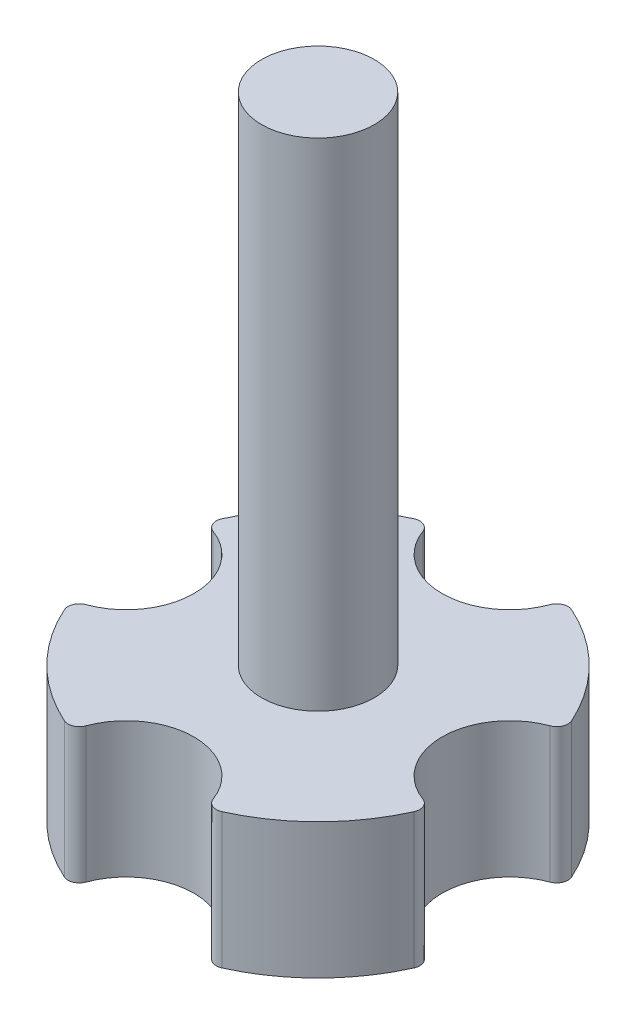
from build123d import *

# Parameters (mm, degrees)
SKETCH1_R           = 8.5
BOSS_EXTRUDE1_DEPTH = 6
SKETCH2_R           = 2.5
BOSS_EXTRUDE2_DEPTH = 22
SKETCH3_R           = 3
CUT_EXTRUDE1_DEPTH  = 13
FILLET1_R           = 0.5


with BuildPart() as part:
    # Sketch1 → Boss-Extrude1 (new body)
    with BuildSketch(Plane(origin=(0, 0, 0), x_dir=(1, 0, 0), z_dir=(0, 1, 0))):
        with Locations(Location((0, 0, 0), (0, 0, 270))):
            Circle(SKETCH1_R)
    extrude(amount=BOSS_EXTRUDE1_DEPTH)

    # Sketch2 → Boss-Extrude2 (add)
    with BuildSketch(Plane(origin=(0, 6, 0), x_dir=(1, 0, 0), z_dir=(0, 1, 0))):
        with Locations(Location((0, 0, 0), (0, 0, 270))):
            Circle(SKETCH2_R)
    extrude(amount=BOSS_EXTRUDE2_DEPTH)

    # Sketch3 → Cut-Extrude1 (cut)
    with BuildSketch(Plane(origin=(0, 6, 0), x_dir=(1, 0, 0), z_dir=(0, 1, 0))):
        with Locations((-8.5, 0)):
            Circle(SKETCH3_R)
        with Locations((0, 8.5)):
            Circle(SKETCH3_R)
        with Locations((8.5, 0)):
            Circle(SKETCH3_R)
        with Locations((0, -8.5)):
            Circle(SKETCH3_R)
    extrude(amount=-CUT_EXTRUDE1_DEPTH, mode=Mode.SUBTRACT)

    # Fillet1
    fillet1_edges = [part.edges().sort_by_distance(p)[0] for p in [
        (-7.970588235, 3, -2.952917741),
        (-7.970588235, 3, 2.952917741),
        (2.952917741, 3, -7.970588235),
        (-2.952917741, 3, -7.970588235),
        (7.970588235, 3, 2.952917741),
        (7.970588235, 3, -2.952917741),
        (-2.952917741, 3, 7.970588235),
        (2.952917741, 3, 7.970588235),
    ]]
    fillet(fillet1_edges, radius=FILLET1_R)


solid = part.part
